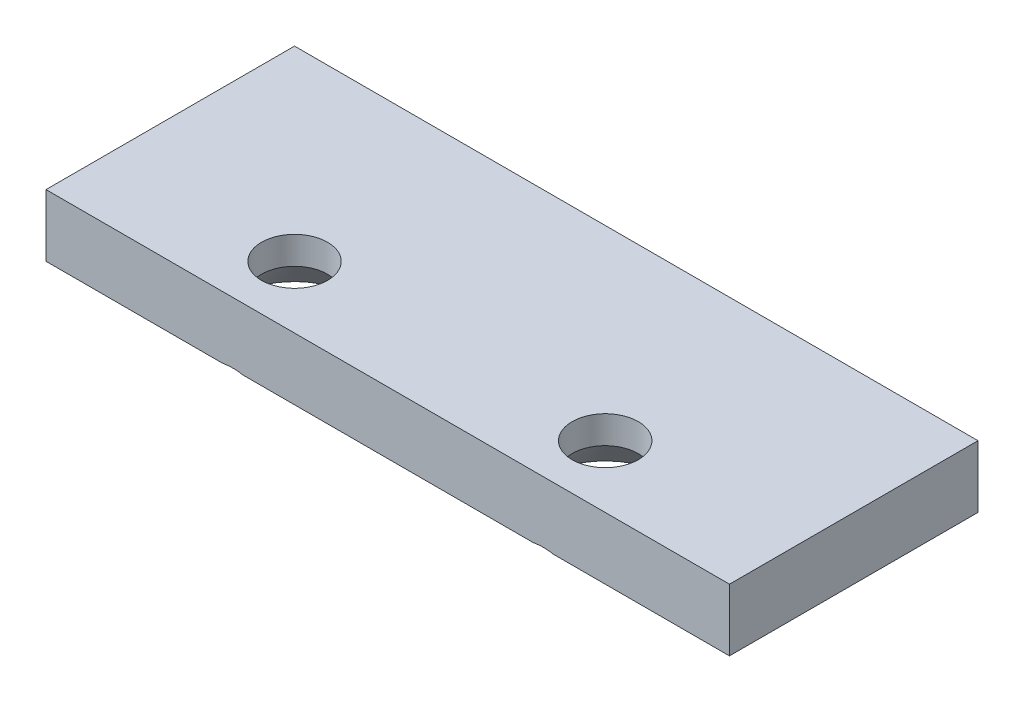
from build123d import *

# Parameters (mm, degrees)
SKETCH1_W                                        = 69.85
SKETCH1_H                                        = 25.4
BOSS_EXTRUDE1_DEPTH                              = 6.35
CSK_FOR_1_4_FLAT_HEAD_MACHINE_SCREW1_D           = 6.7564
CSK_FOR_1_4_FLAT_HEAD_MACHINE_SCREW1_DEPTH       = 15.24
CSK_FOR_1_4_FLAT_HEAD_MACHINE_SCREW1_CSINK_D     = 12.8778
CSK_FOR_1_4_FLAT_HEAD_MACHINE_SCREW1_CSINK_ANGLE = 82
CSK_FOR_1_4_FLAT_HEAD_MACHINE_SCREW1_TIP         = 2.029827343


with BuildPart() as part:
    # Sketch1 → Boss-Extrude1 (new body)
    with BuildSketch(Plane(origin=(0, 0, 0), x_dir=(1, 0, 0), z_dir=(0, 1, 0))):
        Rectangle(SKETCH1_W, SKETCH1_H)
    extrude(amount=BOSS_EXTRUDE1_DEPTH)

    # CSK for 1/4 Flat Head Machine Screw1
    with Locations(Plane(origin=(0, 0, 0), x_dir=(-1, 0, 0), z_dir=(0, -1, 0))):
        with Locations((15.875, -6.35), (-15.875, -6.35)):
            CounterSinkHole(CSK_FOR_1_4_FLAT_HEAD_MACHINE_SCREW1_D / 2, CSK_FOR_1_4_FLAT_HEAD_MACHINE_SCREW1_CSINK_D / 2, depth=CSK_FOR_1_4_FLAT_HEAD_MACHINE_SCREW1_DEPTH, counter_sink_angle=CSK_FOR_1_4_FLAT_HEAD_MACHINE_SCREW1_CSINK_ANGLE)
            with Locations((0, 0, -(CSK_FOR_1_4_FLAT_HEAD_MACHINE_SCREW1_DEPTH + CSK_FOR_1_4_FLAT_HEAD_MACHINE_SCREW1_TIP / 2))):  # 118° drill point
                Cone(0, CSK_FOR_1_4_FLAT_HEAD_MACHINE_SCREW1_D / 2, CSK_FOR_1_4_FLAT_HEAD_MACHINE_SCREW1_TIP, mode=Mode.SUBTRACT)


solid = part.part
